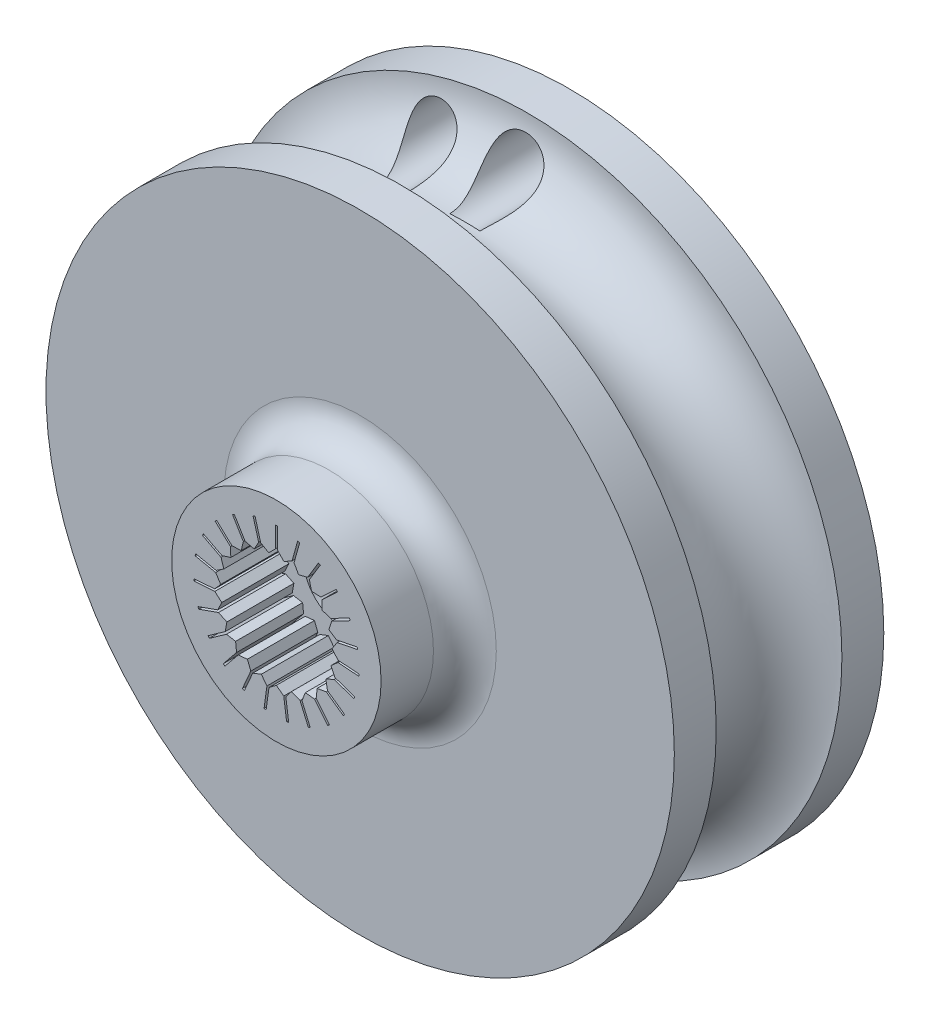
from build123d import *

# Parameters (mm, degrees)
SKETCH_6_R          = 5
EXTRUDE_3_DEPTH     = 4
CUT_EXTRUDE_START   = 4
CUT_EXTRUDE_5_DEPTH = 3.2
FILLET_2_R          = 1.5
SKETCH_9_R          = 1.9
CUT_EXTRUDE_6_DEPTH = 26.416530054
SKETCH_10_R         = 3
CUT_EXTRUDE_7_DEPTH = 5.8
SKETCH_11_R         = 1.25
CUT_EXTRUDE_8_DEPTH = 5


with BuildPart() as part:
    # ｽｹｯﾁ8 → 回転1 (revolve)
    with BuildSketch(Plane(origin=(0, 0, 0), x_dir=(1, 0, 0), z_dir=(0, 1, 0))):
        with BuildLine():
            Line((0, 0), (0, 10))
            Line((0, 10), (15, 10))
            Line((15, 10), (15, 8))
            ThreePointArc((15, 8), (12, 5), (15, 2))
            Line((15, 2), (15, 0))
            Line((15, 0), (0, 0))
        make_face()
    revolve(axis=Axis((0, 0, 0), (0, 0, -1)))

    # ｽｹｯﾁ6 → ﾎﾞｽ - 押し出し3 (add)
    with BuildSketch(Plane.XY):
        Circle(SKETCH_6_R)
    extrude(amount=EXTRUDE_3_DEPTH)

    # ｽｹｯﾁ5 → ｶｯﾄ - 押し出し5 (cut)
    with BuildSketch(Plane.XY.offset(CUT_EXTRUDE_START)):
        Polygon((-0.05, 2.95), (-0.05, 3.95), (0.05, 3.95), (0.05, 2.95), (0.362514094, 2.637485906), (0.747754611, 2.854095836), (1.017551382, 3.817013124), (1.11384311, 3.790033446), (0.844046339, 2.827116159), (1.060656269, 2.441875642), (1.490051682, 2.546516441), (2.009635632, 3.400935845), (2.095077573, 3.34897745), (1.575493623, 2.494558046), (1.680134421, 2.065162633), (2.121838437, 2.050073571), (2.852674402, 2.732626714), (2.920929716, 2.659543117), (2.190093752, 1.976989974), (2.17500469, 1.535285958), (2.596258142, 1.401586122), (3.484143361, 1.86165116), (3.530149865, 1.772862638), (2.642264646, 1.3127976), (2.50856481, 0.891544148), (2.878125258, 0.649149443), (3.857209346, 0.852605456), (3.877554947, 0.754697047), (2.898470859, 0.551241034), (2.656076155, 0.181680586), (2.94653499, -0.151431681), (3.944203759, -0.219674094), (3.937379518, -0.319440971), (2.939710748, -0.251198558), (2.606598481, -0.541657393), (2.796413701, -0.94078181), (3.738674623, -1.275661422), (3.705186662, -1.369887514), (2.76292574, -1.035007902), (2.363801323, -1.224823122), (2.4388952, -1.660358456), (3.255865093, -2.237038778), (3.198197061, -2.318735767), (2.381227168, -1.742055445), (1.945691834, -1.817149322), (1.900495, -2.25679391), (2.531582945, -3.032505201), (2.454011816, -3.095613995), (1.822923871, -2.319902705), (1.383279283, -2.274705871), (1.22114378, -2.685853285), (1.61954487, -3.603064586), (1.52782374, -3.642904695), (1.12942265, -2.725693394), (0.718275236, -2.563557891), (0.451225912, -2.915715208), (0.587392561, -3.906401154), (0.488323967, -3.920017819), (0.352157318, -2.929331873), (0, -2.66228255), (-0.352157318, -2.929331873), (-0.488323967, -3.920017819), (-0.587392561, -3.906401154), (-0.451225912, -2.915715208), (-0.718275236, -2.563557891), (-1.12942265, -2.725693394), (-1.52782374, -3.642904695), (-1.61954487, -3.603064586), (-1.22114378, -2.685853285), (-1.383279283, -2.274705871), (-1.822923871, -2.319902705), (-2.454011816, -3.095613995), (-2.531582945, -3.032505201), (-1.900495, -2.25679391), (-1.945691834, -1.817149322), (-2.381227168, -1.742055445), (-3.198197061, -2.318735767), (-3.255865093, -2.237038778), (-2.4388952, -1.660358456), (-2.363801323, -1.224823122), (-2.76292574, -1.035007902), (-3.705186662, -1.369887514), (-3.738674623, -1.275661422), (-2.796413701, -0.94078181), (-2.606598481, -0.541657393), (-2.939710748, -0.251198558), (-3.937379518, -0.319440971), (-3.944203759, -0.219674094), (-2.94653499, -0.151431681), (-2.656076155, 0.181680586), (-2.898470859, 0.551241034), (-3.877554947, 0.754697047), (-3.857209346, 0.852605456), (-2.878125258, 0.649149443), (-2.50856481, 0.891544148), (-2.642264646, 1.3127976), (-3.530149865, 1.772862638), (-3.484143361, 1.86165116), (-2.596258142, 1.401586122), (-2.17500469, 1.535285958), (-2.190093752, 1.976989974), (-2.920929716, 2.659543117), (-2.852674402, 2.732626714), (-2.121838437, 2.050073571), (-1.680134421, 2.065162633), (-1.575493623, 2.494558046), (-2.095077573, 3.34897745), (-2.009635632, 3.400935845), (-1.490051682, 2.546516441), (-1.060656269, 2.441875642), (-0.844046339, 2.827116159), (-1.11384311, 3.790033446), (-1.017551382, 3.817013124), (-0.747754611, 2.854095836), (-0.362514094, 2.637485906), align=None)
    extrude(amount=-CUT_EXTRUDE_5_DEPTH, mode=Mode.SUBTRACT)

    # ﾌｨﾚｯﾄ2
    fillet_2_edges = [part.edges().sort_by_distance(p)[0] for p in [
        (-5, 0, 0),
    ]]
    fillet(fillet_2_edges, radius=FILLET_2_R)

    # ｽｹｯﾁ9 → ｶｯﾄ - 押し出し6 (cut, through all)
    with BuildSketch(Plane(origin=(0, 0, -10), x_dir=(-1, 0, 0), z_dir=(0, 0, -1))):
        Circle(SKETCH_9_R)
    extrude(amount=-CUT_EXTRUDE_6_DEPTH, mode=Mode.SUBTRACT)

    # ｽｹｯﾁ10 → ｶｯﾄ - 押し出し7 (cut)
    with BuildSketch(Plane(origin=(0, 0, -10), x_dir=(-1, 0, 0), z_dir=(0, 0, -1))):
        Circle(SKETCH_10_R)
    extrude(amount=-CUT_EXTRUDE_7_DEPTH, mode=Mode.SUBTRACT)

    # ｽｹｯﾁ11 → ｶｯﾄ - 押し出し8 (cut)
    with BuildSketch(Plane.XY.offset(-10)):
        with Locations(Location((0, 13, 0), (0, 0, 234.816184512))):
            Circle(SKETCH_11_R)
        with Locations(Location((-3.952379255, 12.384615385, 0), (0, 0, 252.515950709))):
            Circle(SKETCH_11_R)
    extrude(amount=CUT_EXTRUDE_8_DEPTH, mode=Mode.SUBTRACT)


solid = part.part
